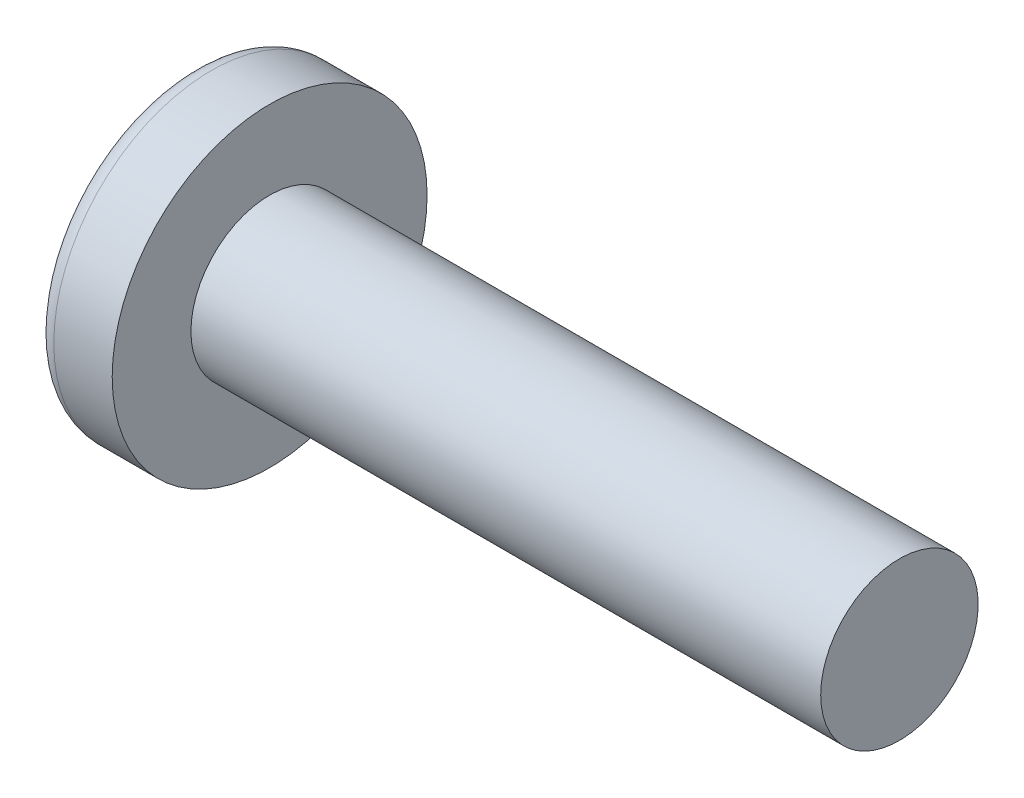
from build123d import *

# Parameters (mm, degrees)
CIRPATTERN1_COUNT = 2
CIRPATTERN1_ANGLE = 90


with BuildPart() as part:
    # BodySke → Base-Revolve (revolve)
    with BuildSketch(Plane.XY, mode=Mode.PRIVATE) as base_revolve_sk:
        with BuildLine():
            Line((3.1, 2), (3.1, 4))
            Line((3.1, 4), (1.616353821, 4))
            ThreePointArc((1.616353821, 4), (1.397629036, 3.947269784), (1.226960106, 3.800664452))
            ThreePointArc((1.226960106, 3.800664452), (0.314340807, 1.996902688), (0, 0))
            Line((0, 0), (19.1, 0))
            Line((19.1, 0), (19.1, 2))
            Line((19.1, 2), (3.1, 2))
        make_face()
    revolve(base_revolve_sk.sketch.rotate(Axis((-25.4, 0, 0), (1, 0, 0)), 90), axis=Axis((-25.4, 0, 0), (1, 0, 0)))

    # Sketch3 → Cut-Loft1 section 0
    with BuildSketch(Plane(origin=(0, 0, 0), x_dir=(0, 0, -1), z_dir=(1, 0, 0))):
        with BuildLine():
            Line((0.465, -2.2), (-0.465, -2.2))
            Line((-0.465, -2.2), (-0.465, 2.2))
            Line((-0.465, 2.2), (0.465, 2.2))
            Line((0.465, 2.2), (0.465, -2.2))
        make_face()
    # Sketch4 → Cut-Loft1 section 1
    with BuildSketch(Plane(origin=(2.45, 0, 0), x_dir=(0, 0, -1), z_dir=(1, 0, 0))):
        with BuildLine():
            Line((0.2325, -0.2325), (-0.2325, -0.2325))
            Line((-0.2325, -0.2325), (-0.2325, 0.2325))
            Line((-0.2325, 0.2325), (0.2325, 0.2325))
            Line((0.2325, 0.2325), (0.2325, -0.2325))
        make_face()
    cut_loft1 = loft(mode=Mode.SUBTRACT)

    # CirPattern1: Cut-Loft1 ×2 about axis
    cirpattern1_axis = Axis((0, 0, 0), (1, 0, 0))
    for i in range(1, CIRPATTERN1_COUNT):
        add(cut_loft1.rotate(cirpattern1_axis, i * CIRPATTERN1_ANGLE / (CIRPATTERN1_COUNT - 1)), mode=Mode.SUBTRACT)


solid = part.part
